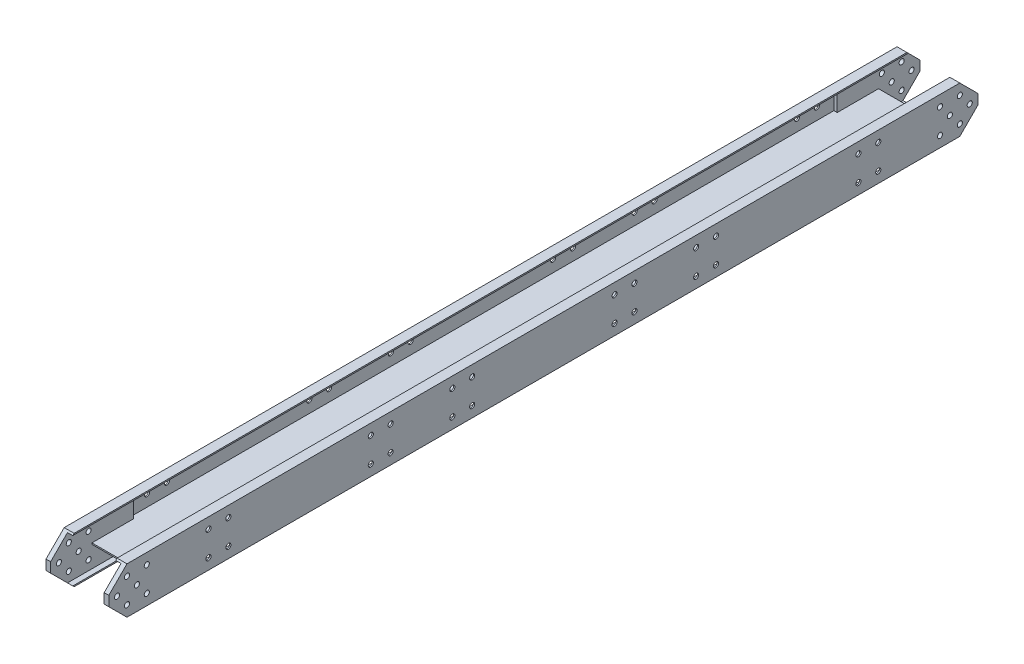
from build123d import *

# Parameters (mm, degrees)
EXTRUDE_1_DEPTH     = 2630
SKETCH_2_W          = 500
SKETCH_2_H          = 264
EXTRUDE_2_DEPTH     = 20
SKETCH_4_W          = 2380
SKETCH_4_H          = 8
EXTRUDE_4_DEPTH     = 182
SKETCH_5_R          = 15.5
CUT_EXTRUDE_6_DEPTH = 2661.996054112


with BuildPart() as part:
    # 草图1 → 拉伸1 (new body)
    with BuildSketch(Plane.XY):
        Polygon((-130, 140), (-190, 140), (-190, -140), (-130, -140), (-130, -132), (-182, -132), (-182, 132), (-130, 132), align=None)
    extrude(amount=EXTRUDE_1_DEPTH)

    # 草图2 → 拉伸2 (add)
    with BuildSketch(Plane(origin=(-182, 0, 0), x_dir=(0, 0, -1), z_dir=(1, 0, 0))):
        with Locations((-2380, 0)):
            Rectangle(SKETCH_2_W, SKETCH_2_H)
    extrude(amount=EXTRUDE_2_DEPTH)

    # 草图4 → 拉伸4 (add)
    with BuildSketch(Plane(origin=(-182, 0, 0), x_dir=(0, 0, -1), z_dir=(1, 0, 0))):
        with Locations((-1190, 0)):
            Rectangle(SKETCH_4_W, SKETCH_4_H)
    extrude(amount=EXTRUDE_4_DEPTH)

    # 镜向2: part across plane


with BuildPart() as part_1:
    add(part.part)
    add(part.part.mirror(Plane(origin=(0, -4, 2380), x_dir=(0, 0, 1), z_dir=(1, 0, 0))))

    # 草图5 → 拉伸6 (cut, through all)
    with BuildSketch(Plane(origin=(190, 0, 0), x_dir=(0, 0, -1), z_dir=(1, 0, 0))):
        Polygon((-2630, 30), (-2520, 140), (-2630, 140), align=None)
        Polygon((-2520, -140), (-2630, -30), (-2630, -140), align=None)
        with Locations((-2580, 0)):
            Circle(SKETCH_5_R)
        with Locations((-2520, 75)):
            Circle(SKETCH_5_R)
        with Locations((-2400, 75)):
            Circle(SKETCH_5_R)
        with Locations((-2400, -75)):
            Circle(SKETCH_5_R)
        with Locations((-2026.5, -75)):
            Circle(SKETCH_5_R)
        with Locations((-2026.5, 75)):
            Circle(SKETCH_5_R)
        with Locations((-1906.5, 75)):
            Circle(SKETCH_5_R)
        with Locations((-1906.5, -75)):
            Circle(SKETCH_5_R)
        with Locations((-2520, -75)):
            Circle(SKETCH_5_R)
        with Locations((-2460, 0)):
            Circle(SKETCH_5_R)
        with Locations((-1044.5, 75)):
            Circle(SKETCH_5_R)
        with Locations((-924.5, 75)):
            Circle(SKETCH_5_R)
        with Locations((-1044.5, -75)):
            Circle(SKETCH_5_R)
        with Locations((-924.5, -75)):
            Circle(SKETCH_5_R)
        with Locations((-551, 75)):
            Circle(SKETCH_5_R)
        with Locations((-431, 75)):
            Circle(SKETCH_5_R)
        with Locations((-551, -75)):
            Circle(SKETCH_5_R)
        with Locations((-431, -75)):
            Circle(SKETCH_5_R)
    extrude(amount=-CUT_EXTRUDE_6_DEPTH, mode=Mode.SUBTRACT)

    # 镜向3: part across plane


with BuildPart() as part_2:
    add(part_1.part)
    add(part_1.part.mirror(Plane.XY))


solid = part_2.part
